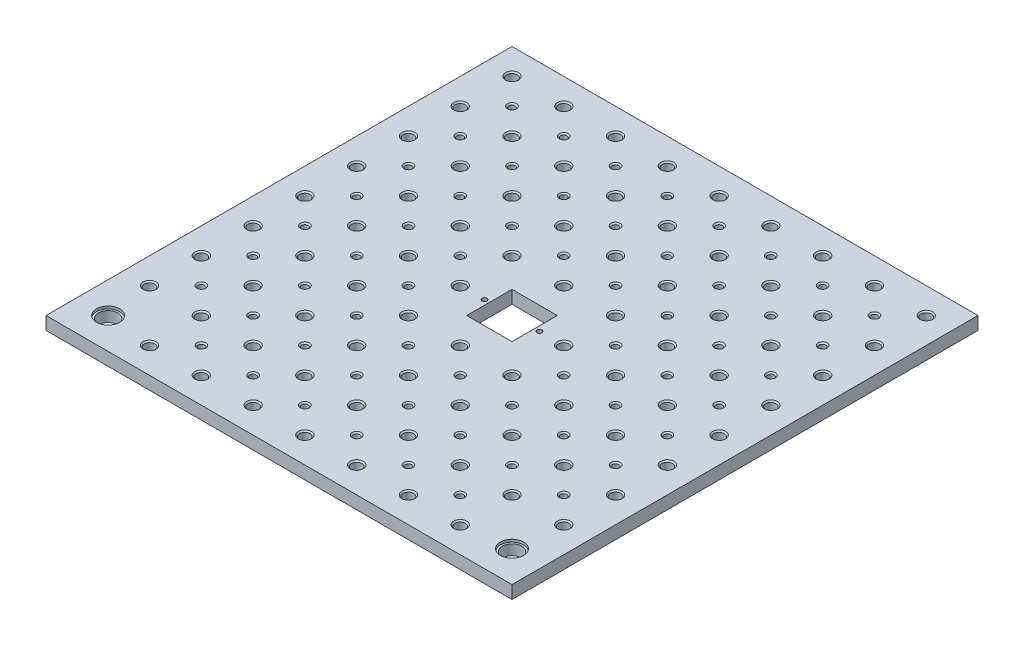
from build123d import *

# Parameters (mm, degrees)
SKETCH1_W                                   = 228.6
SKETCH1_H                                   = 228.6
BOSS_EXTRUDE1_DEPTH                         = 3.175
SKETCH2_W                                   = 22.225
SKETCH2_H                                   = 22.225
CUT_EXTRUDE1_DEPTH                          = 162.769287876
BEARING_MOUNTING_PRESSFIT_HOLE_D            = 9.525
BEARING_MOUNTING_PRESSFIT_HOLE_CBORE_D      = 11.43
BEARING_MOUNTING_PRESSFIT_HOLE_CBORE_DEPTH  = 1.27
TAPPED_HOLE_FOR_10_32_HELICOIL1_D           = 5.1054
TAPPED_HOLE_FOR_10_32_HELICOIL1_CSINK_D     = 6.3754
TAPPED_HOLE_FOR_10_32_HELICOIL1_CSINK_ANGLE = 90
F_1_8_0_1250_DOWEL_HOLE1_D                  = 3.175
F_1_8_0_1250_DOWEL_HOLE1_CSINK_D            = 4.445
F_1_8_0_1250_DOWEL_HOLE1_CSINK_ANGLE        = 90
THREAD_HOLE_PATTERN_COUNT                   = 9
THREAD_HOLE_PATTERN_PITCH                   = 25.4
THREAD_HOLE_PATTERN_COUNT_DIR2              = 9
THREAD_HOLE_PATTERN_PITCH_DIR2              = 25.4
PIN_HOLE_PATTERN_COUNT                      = 8
PIN_HOLE_PATTERN_PITCH                      = 25.4
PIN_HOLE_PATTERN_COUNT_DIR2                 = 8
PIN_HOLE_PATTERN_PITCH_DIR2                 = 25.4
TAPPED_HOLE_FOR_2_56_HELICOIL1_D            = 2.38252


with BuildPart() as part:
    # Sketch1 → Boss-Extrude1 (new, symmetric)
    with BuildSketch(Plane(origin=(0, 0, 0), x_dir=(1, 0, 0), z_dir=(0, 1, 0))):
        Rectangle(SKETCH1_W, SKETCH1_H)
    extrude(amount=BOSS_EXTRUDE1_DEPTH, both=True)

    # Sketch2 → Cut-Extrude1 (cut, through all)
    with BuildSketch(Plane(origin=(0, 3.175, 0), x_dir=(1, 0, 0), z_dir=(0, 1, 0))):
        Rectangle(SKETCH2_W, SKETCH2_H)
    extrude(amount=-CUT_EXTRUDE1_DEPTH, mode=Mode.SUBTRACT)

    # Bearing Mounting Pressfit Hole (through all)
    with Locations(Plane(origin=(0, 3.175, 0), x_dir=(1, 0, 0), z_dir=(0, 1, 0))):
        with Locations((-99.06, -99.06), (99.06, -99.06)):
            CounterBoreHole(BEARING_MOUNTING_PRESSFIT_HOLE_D / 2, BEARING_MOUNTING_PRESSFIT_HOLE_CBORE_D / 2, BEARING_MOUNTING_PRESSFIT_HOLE_CBORE_DEPTH)

    # Tapped Hole for #10-32 Helicoil1 (through all)
    with Locations(Plane(origin=(0, 3.175, 0), x_dir=(1, 0, 0), z_dir=(0, 1, 0))):
        with Locations((-101.6, 101.6)):
            tapped_hole_for_10_32_helicoil1 = CounterSinkHole(TAPPED_HOLE_FOR_10_32_HELICOIL1_D / 2, TAPPED_HOLE_FOR_10_32_HELICOIL1_CSINK_D / 2, counter_sink_angle=TAPPED_HOLE_FOR_10_32_HELICOIL1_CSINK_ANGLE)

    # 1/8 (0.1250) Dowel Hole1 (through all)
    with Locations(Plane(origin=(0, 3.175, 0), x_dir=(1, 0, 0), z_dir=(0, 1, 0))):
        with Locations((-88.9, 88.9), (-101.6, 101.6)):
            f_1_8_0_1250_dowel_hole1 = CounterSinkHole(F_1_8_0_1250_DOWEL_HOLE1_D / 2, F_1_8_0_1250_DOWEL_HOLE1_CSINK_D / 2, counter_sink_angle=F_1_8_0_1250_DOWEL_HOLE1_CSINK_ANGLE)

    # Thread Hole Pattern: Tapped Hole for _10-32 Helicoil1 9 × 9, 3 skipped
    with Locations(*[(i * THREAD_HOLE_PATTERN_PITCH, 0, j * THREAD_HOLE_PATTERN_PITCH_DIR2) for i in range(THREAD_HOLE_PATTERN_COUNT) for j in range(THREAD_HOLE_PATTERN_COUNT_DIR2) if (i, j) not in ((0, 0), (0, 8), (4, 4), (8, 8))]):
        add(tapped_hole_for_10_32_helicoil1, mode=Mode.SUBTRACT)

    # Pin Hole Pattern: 1_8 _0.1250_ Dowel Hole1 8 × 8, 6 skipped
    with Locations(*[(i * PIN_HOLE_PATTERN_PITCH, 0, j * PIN_HOLE_PATTERN_PITCH_DIR2) for i in range(PIN_HOLE_PATTERN_COUNT) for j in range(PIN_HOLE_PATTERN_COUNT_DIR2) if (i, j) not in ((0, 0), (0, 7), (3, 3), (3, 4), (4, 3), (4, 4), (7, 7))]):
        add(f_1_8_0_1250_dowel_hole1, mode=Mode.SUBTRACT)

    # Tapped Hole for #2-56 Helicoil1 (through all)
    with Locations(Plane(origin=(0, 3.175, 0), x_dir=(1, 0, 0), z_dir=(0, 1, 0))):
        with Locations((-13.5, 0), (13.5, 0)):
            Hole(TAPPED_HOLE_FOR_2_56_HELICOIL1_D / 2)


solid = part.part
